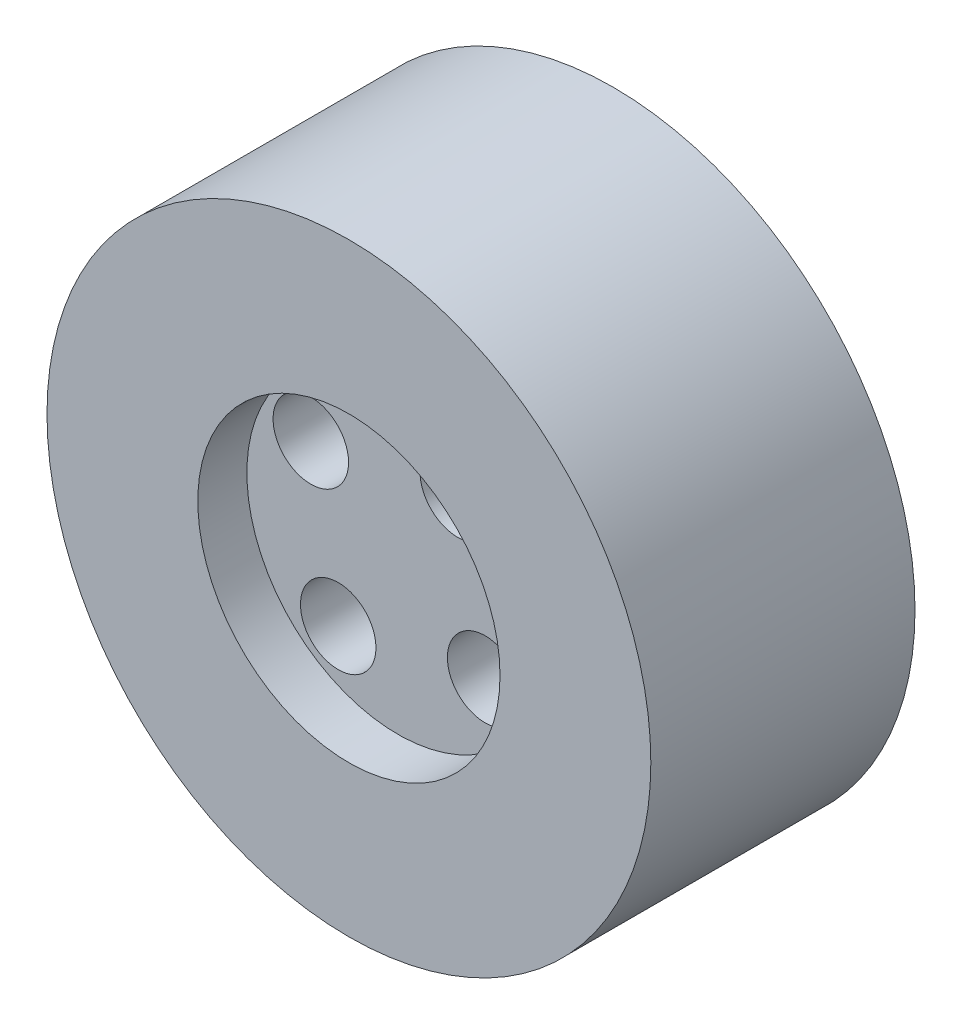
from build123d import *

# Parameters (mm, degrees)
SKETCH1_R           = 40
BOSS_EXTRUDE1_DEPTH = 35
SKETCH2_R           = 20.02
CUT_EXTRUDE2_DEPTH  = 6.5
SKETCH3_R           = 5
CUT_EXTRUDE3_DEPTH  = 67.520673478
CIRPATTERN1_COUNT   = 4


with BuildPart() as part:
    # Sketch1 → Boss-Extrude1 (new body)
    with BuildSketch(Plane.XY):
        Circle(SKETCH1_R)
    extrude(amount=BOSS_EXTRUDE1_DEPTH)

    # Sketch2 → Cut-Extrude2 (cut)
    with BuildSketch(Plane.XY.offset(35)):
        Circle(SKETCH2_R)
    extrude(amount=-CUT_EXTRUDE2_DEPTH, mode=Mode.SUBTRACT)

    # Sketch3 → Cut-Extrude3 (cut, through all)
    with BuildSketch(Plane.XY.offset(35)):
        with Locations((-11.545851026, 7.917911598)):
            Circle(SKETCH3_R)
    cut_extrude3 = extrude(amount=-CUT_EXTRUDE3_DEPTH, mode=Mode.SUBTRACT)

    # CirPattern1: Cut-Extrude3 ×4 about axis
    cirpattern1_axis = Axis((0, 0, 0), (0, 0, 1))
    for i in range(1, CIRPATTERN1_COUNT):
        add(cut_extrude3.rotate(cirpattern1_axis, i * 360 / CIRPATTERN1_COUNT), mode=Mode.SUBTRACT)


solid = part.part
